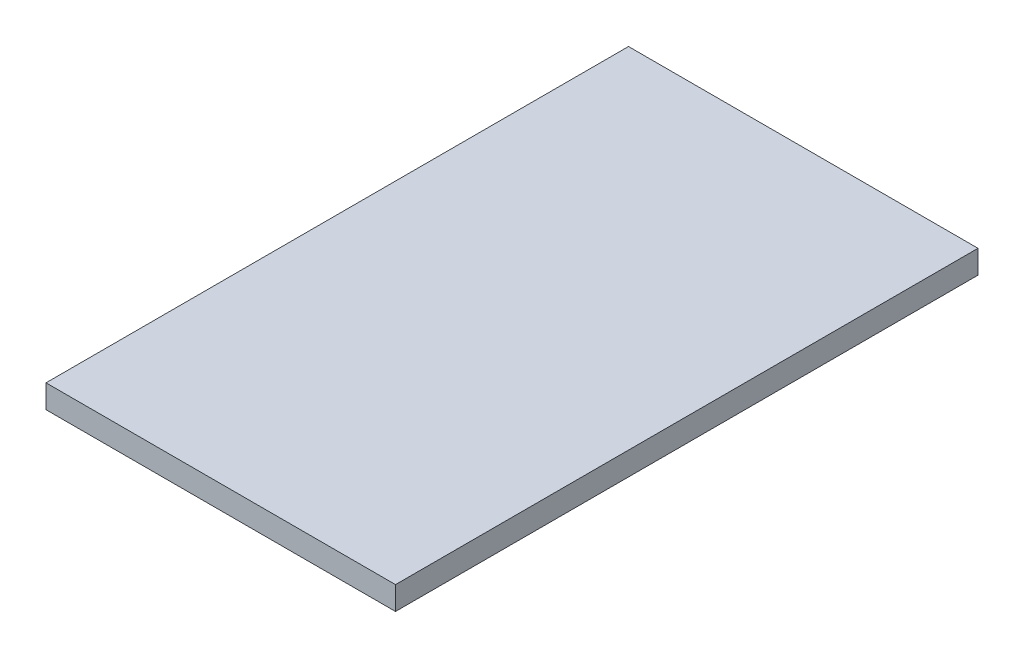
from build123d import *

# Parameters (mm, degrees)
SKETCH1_W           = 30
SKETCH1_H           = 50
BOSS_EXTRUDE1_DEPTH = 2


with BuildPart() as part:
    # Sketch1 → Boss-Extrude1 (new body)
    with BuildSketch(Plane(origin=(0, 0, 0), x_dir=(1, 0, 0), z_dir=(0, 1, 0))):
        with Locations((15, 25)):
            Rectangle(SKETCH1_W, SKETCH1_H)
    extrude(amount=BOSS_EXTRUDE1_DEPTH)


solid = part.part
